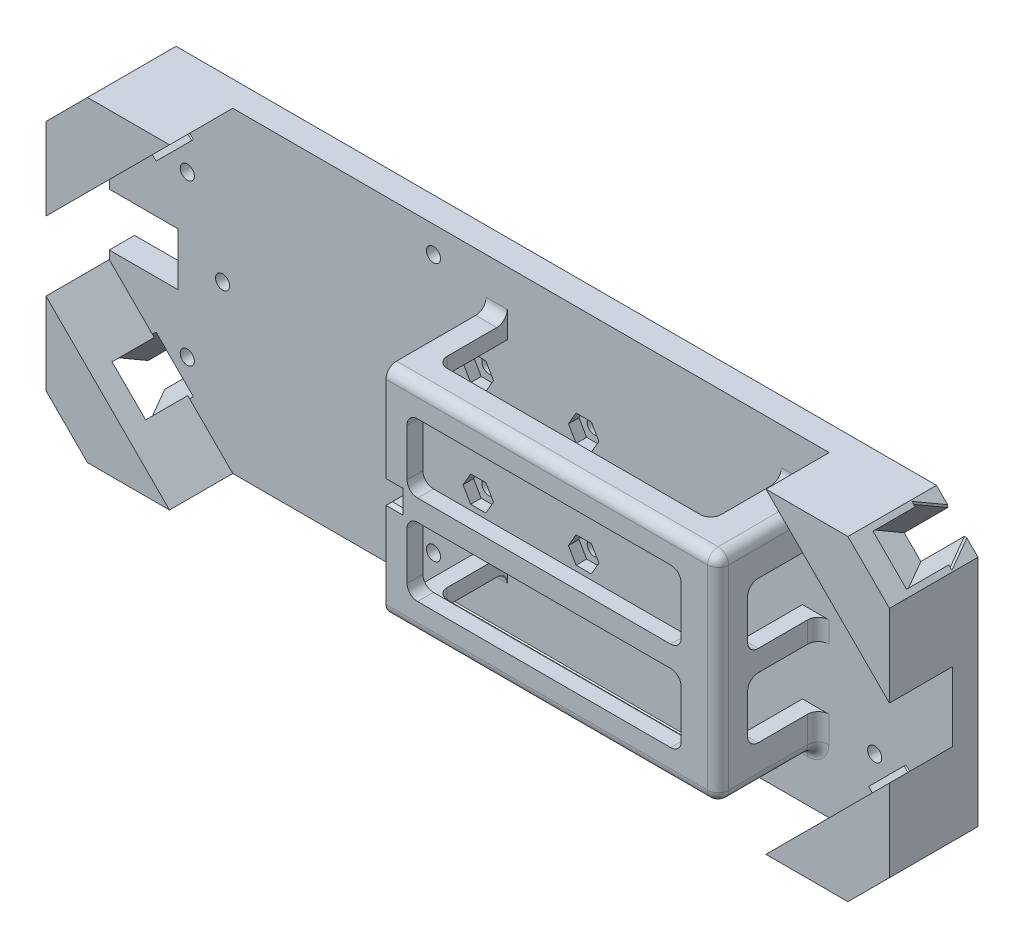
from build123d import *

# Parameters (mm, degrees)
BOSS_EXTRUDE1_DEPTH            = 27.432
BOSS_EXTRUDE2_DEPTH            = 5.08
SKETCH4_R                      = 1.524
CUT_EXTRUDE1_DEPTH             = 2.286
SKETCH4_4_R                    = 1.524
CUT_EXTRUDE2_DEPTH             = 63.630575033
BOSS_EXTRUDE3_DEPTH            = 3.81
FILLET1_R                      = 2.54
CHAMFER3_SIZE                  = 1.27
CHAMFER4_SIZE                  = 0.254
SKETCH8_W                      = 101.6
SKETCH8_H                      = 44.45
CUT_EXTRUDE3_DEPTH             = 5.08
CHAMFER5_SIZE                  = 1.27
BOSS_EXTRUDE4_DEPTH            = 6.096
FILLET2_R                      = 1.27
CUT_EXTRUDE4_DEPTH             = 15.24
MIRROR3_COPY_1_DEPTH           = 15.24
CHAMFER7_SIZE                  = 0.381
SKETCH19_W                     = 135.869666512
SKETCH19_H                     = 67.345799606
CUT_EXTRUDE9_DEPTH             = 31.242
BOSS_EXTRUDE6_DEPTH            = 20.32
SKETCH21_W                     = 80.01
SKETCH21_H                     = 52.07
BOSS_EXTRUDE7_DEPTH            = 3.81
FILLET3_R                      = 2.54
CHAMFER8_SIZE                  = 1.27
BOSS_EXTRUDE8_DEPTH            = 10.16
BOSS_EXTRUDE10_DEPTH           = 5.08
MIRROR13_COPY_1_DEPTH          = 10.16
MIRROR13_COPY_2_DEPTH          = 5.08
CUT_EXTRUDE11_REACH            = 113.159
SKETCH27_R                     = 1.7
SKETCH28_R                     = 3.302
CUT_EXTRUDE12_DEPTH            = 3.302
CUT_EXTRUDE13_REACH            = 114.64
SKETCH29_W                     = 66.04
SKETCH29_H                     = 16.51
SKETCH30_W                     = 66.04
SKETCH30_H                     = 17.018
CUT_EXTRUDE14_DEPTH            = 123.217293784
CUT_EXTRUDE15_REACH            = 178.668
SKETCH31_W                     = 17.018
SKETCH31_H                     = 14.605
SKETCH32_W                     = 66.04
SKETCH32_H                     = 2.54
CUT_EXTRUDE16_DEPTH            = 123.217293784
SKETCH33_W                     = 2.609855045
SKETCH33_H                     = 34.29
CUT_EXTRUDE17_DEPTH            = 3.302
SKETCH34_R                     = 1.7
CUT_EXTRUDE18_DEPTH            = 112.159466084
SKETCH35_R                     = 3.302
CUT_EXTRUDE19_DEPTH            = 3.302
FILLET4_R                      = 2.54
CBORE_FOR_M3_SHCS1_D           = 3.4
CBORE_FOR_M3_SHCS1_CBORE_D     = 6.5
CBORE_FOR_M3_SHCS1_CBORE_DEPTH = 3
MIRROR15_COPY_1_D              = 3.4
MIRROR15_COPY_1_CBORE_D        = 6.5
MIRROR15_COPY_1_CBORE_DEPTH    = 3
CUT_EXTRUDE20_REACH            = 114.64
SKETCH38_W                     = 11.43
SKETCH38_H                     = 7.62
CHAMFER10_SIZE                 = 0.762
M3_CLEARANCE_HOLE1_D           = 3.4
MIRROR17_COPY_1_D              = 3.4
CUT_EXTRUDE21_DEPTH            = 2.54
MIRROR19_COPY_1_DEPTH          = 2.54
CUT_EXTRUDE22_REACH            = 114.64
SKETCH43_W                     = 6.604
SKETCH43_H                     = 4.064
CHAMFER11_SIZE                 = 0.762
SKETCH44_W                     = 33.083921372
SKETCH44_H                     = 12.7
CUT_EXTRUDE23_DEPTH            = 112.159466084


with BuildPart() as part:
    # Sketch1 → Boss-Extrude1 (new body)
    with BuildSketch(Plane(origin=(10.858740921, 0, 0), x_dir=(1, 0, 0), z_dir=(0, 0, 1))):
        Polygon((-52.705, 25.4), (-52.705, 21.59), (48.895, 21.59), (48.895, -22.86), (-52.705, -22.86), (-52.705, -25.4), (52.705, -25.4), (52.705, 25.4), align=None)
    extrude(amount=BOSS_EXTRUDE1_DEPTH)

    # Sketch1<3> → Boss-Extrude2 (add)
    with BuildSketch(Plane(origin=(10.858740921, 0, 0), x_dir=(1, 0, 0), z_dir=(0, 0, 1))):
        Polygon((48.895, 21.59), (-52.705, 21.59), (-52.705, 13.97), (-6.985, 13.97), (-6.985, -6.35), (-52.705, -6.35), (-52.705, -22.86), (48.895, -22.86), align=None)
    extrude(amount=BOSS_EXTRUDE2_DEPTH)

    # Sketch4 → Cut-Extrude1 (cut)
    # profile 1 of 4: a face of its own
    with BuildSketch(Plane(origin=(10.858740921, 0, 5.08), x_dir=(1, 0, 0), z_dir=(0, 0, 1))):
        Polygon((-44.785877438, 21.59), (-47.924122562, 21.59), (-49.493245123, 18.8722), (-47.924122562, 16.1544), (-44.785877438, 16.1544), (-43.216754877, 18.8722), align=None)
        with Locations((-46.355, 18.8722)):
            Circle(SKETCH4_R, mode=Mode.SUBTRACT)
    # profile 2 of 4: a face of its own
    with BuildSketch(Plane(origin=(10.858740921, 0, 5.08), x_dir=(1, 0, 0), z_dir=(0, 0, 1))):
        Polygon((21.126640721, 16.1544), (17.988395597, 16.1544), (16.419273036, 18.8722), (17.988395597, 21.59), (21.126640721, 21.59), (22.695763282, 18.8722), align=None)
        with Locations((19.557518159, 18.8722)):
            Circle(SKETCH4_R, mode=Mode.SUBTRACT)
    # profile 3 of 4: a face of its own
    with BuildSketch(Plane(origin=(10.858740921, 0, 5.08), x_dir=(1, 0, 0), z_dir=(0, 0, 1))):
        Polygon((22.695763282, -18.8722), (21.126640721, -16.1544), (17.988395597, -16.1544), (16.419273036, -18.8722), (17.988395597, -21.59), (21.126640721, -21.59), align=None)
        with Locations((19.557518159, -18.8722)):
            Circle(SKETCH4_R, mode=Mode.SUBTRACT)
    # profile 4 of 4: a face of its own
    with BuildSketch(Plane(origin=(10.858740921, 0, 5.08), x_dir=(1, 0, 0), z_dir=(0, 0, 1))):
        Polygon((-49.493245123, -18.8722), (-47.924122562, -16.1544), (-44.785877438, -16.1544), (-43.216754877, -18.8722), (-44.785877438, -21.59), (-47.924122562, -21.59), align=None)
        with Locations((-46.355, -18.8722)):
            Circle(SKETCH4_R, mode=Mode.SUBTRACT)
    extrude(amount=-CUT_EXTRUDE1_DEPTH, mode=Mode.SUBTRACT)

    # Sketch4<4> → Cut-Extrude2 (cut, through all)
    with BuildSketch(Plane(origin=(10.858740921, 0, 5.08), x_dir=(1, 0, 0), z_dir=(0, 0, 1))):
        with Locations((-46.355, 18.8722)):
            Circle(SKETCH4_4_R)
        with Locations((19.557518159, 18.8722)):
            Circle(SKETCH4_4_R)
        with Locations((-46.355, -18.8722)):
            Circle(SKETCH4_4_R)
        with Locations((19.557518159, -18.8722)):
            Circle(SKETCH4_4_R)
    extrude(amount=-CUT_EXTRUDE2_DEPTH, mode=Mode.SUBTRACT)

    # Sketch7 → Boss-Extrude3 (add)
    with BuildSketch(Plane(origin=(10.858740921, 0, 27.432), x_dir=(1, 0, 0), z_dir=(0, 0, 1))):
        Polygon((-52.705, 25.4), (52.705, 25.4), (52.705, -25.4), (-52.705, -25.4), (-52.705, -6.35), (-46.355, -6.35), (-46.355, 6.35), (-52.705, 6.35), align=None)
    extrude(amount=BOSS_EXTRUDE3_DEPTH)

    # Fillet1
    fillet1_edges = [part.edges().sort_by_distance(p)[0] for p in [
        (63.563740921, 25.4, 15.621),
        (63.563740921, -25.4, 15.621),
        (10.858740921, -25.4, 31.242),
        (63.563740921, 0, 31.242),
        (10.858740921, 25.4, 31.242),
    ]]
    fillet(fillet1_edges, radius=FILLET1_R)

    # Chamfer3
    chamfer3_edges = [part.edges().sort_by_distance(p)[0] for p in [
        (-41.846259079, 13.97, 27.432),
        (-41.846259079, 6.35, 29.337),
        (-41.846259079, 21.59, 16.256),
        (-41.846259079, -14.605, 27.432),
        (-41.846259079, -6.35, 29.337),
        (-38.671259079, 6.35, 31.242),
        (-35.496259079, 0, 31.242),
        (-38.671259079, -6.35, 31.242),
        (-41.846259079, -22.86, 16.256),
    ]]
    chamfer(chamfer3_edges, length=CHAMFER3_SIZE)

    # Chamfer4
    chamfer4_edges = [part.edges().sort_by_distance(p)[0] for p in [
        (28.892259079, 18.8722, 0),
        (-37.020259079, -18.8722, 0),
        (28.892259079, -18.8722, 0),
        (-37.020259079, 18.8722, 0),
    ]]
    chamfer(chamfer4_edges, length=CHAMFER4_SIZE)

    # Sketch8 → Cut-Extrude3 (cut)
    with BuildSketch(Plane(origin=(10.858740921, 0, 5.08), x_dir=(1, 0, 0), z_dir=(0, 0, 1))):
        with Locations((-1.905, -0.635)):
            Rectangle(SKETCH8_W, SKETCH8_H)
    extrude(amount=-CUT_EXTRUDE3_DEPTH, mode=Mode.SUBTRACT)

    # Chamfer5
    chamfer5_edges = [part.edges().sort_by_distance(p)[0] for p in [
        (-41.846259079, -22.86, 2.54),
        (-41.846259079, 21.59, 2.54),
    ]]
    chamfer(chamfer5_edges, length=CHAMFER5_SIZE)

    # Sketch9 → Boss-Extrude4 (add)
    with BuildSketch(Plane(origin=(10.858740921, 0, 0), x_dir=(-1, 0, 0), z_dir=(0, 0, -1))):
        Polygon((-90.741259079, 28.1), (-80.741259079, 38.1), (102.458740921, 38.1), (112.458740921, 28.1), (112.458740921, -28.1), (102.458740921, -38.1), (-80.741259079, -38.1), (-90.741259079, -28.1), align=None)
    extrude(amount=BOSS_EXTRUDE4_DEPTH)

    # Fillet2
    fillet2_edges = [part.edges().sort_by_distance(p)[0] for p in [
        (9.588740921, -25.4, 0),
        (63.563740921, 0, 0),
        (9.588740921, 25.4, 0),
        (62.819792145, 24.656051224, 0),
        (62.819792145, -24.656051224, 0),
    ]]
    fillet(fillet2_edges, radius=FILLET2_R)

    # Sketch13 → Cut-Extrude4 (cut)
    with BuildSketch(Plane(origin=(-64.85, 64.85, 0), x_dir=(0, 0, 1), z_dir=(-0.7071067811865477, 0.7071067811865474, 0))):
        Polygon((-6.096, -44.901280605), (-6.096, -42.070807846), (0, -38.551280605), (0, -51.251280605), (-6.096, -47.731753364), align=None)
    cut_extrude4 = extrude(amount=-CUT_EXTRUDE4_DEPTH, mode=Mode.SUBTRACT)

    # Mirror2: Cut-Extrude4 across plane
    add(cut_extrude4.mirror(Plane.ZX), mode=Mode.SUBTRACT)

    # Mirror3: Cut-Extrude4 across plane
    add(cut_extrude4.mirror(Plane(origin=(0, 0, 0), x_dir=(0, 0, 1), z_dir=(1, 0, 0))), mode=Mode.SUBTRACT)

    # Mirror3 copy 1 sketch → Mirror3 copy 1 (cut)
    with BuildSketch(Plane(origin=(64.85, -64.85, 0), x_dir=(0, 0, 1), z_dir=(0.7071067811865477, -0.7071067811865474, 0))):
        Polygon((-6.096, -44.901280605), (-6.096, -42.070807846), (0, -38.551280605), (0, -51.251280605), (-6.096, -47.731753364), align=None)
    extrude(amount=-MIRROR3_COPY_1_DEPTH, mode=Mode.SUBTRACT)

    # Chamfer7
    chamfer7_edges = [part.edges().sort_by_distance(p)[0] for p in [
        (-99.845787271, 29.854212729, -3.048),
        (-93.354212729, 36.345787271, -3.048),
        (-99.845787271, -29.854212729, -3.048),
        (-93.354212729, -36.345787271, -3.048),
        (99.845787271, 29.854212729, -3.048),
        (93.354212729, 36.345787271, -3.048),
        (99.845787271, -29.854212729, -3.048),
        (93.354212729, -36.345787271, -3.048),
    ]]
    chamfer(chamfer7_edges, length=CHAMFER7_SIZE)

    # Sketch19 → Cut-Extrude9 (cut)
    with BuildSketch(Plane.XY.offset(31.242)):
        Rectangle(SKETCH19_W, SKETCH19_H)
    extrude(amount=-CUT_EXTRUDE9_DEPTH, mode=Mode.SUBTRACT)

    # Sketch20 → Boss-Extrude6 (add)
    with BuildSketch(Plane.XY):
        Polygon((65.405, 22.86), (65.405, -21.59), (-10.795, -21.59), (-10.795, -25.4), (69.215, -25.4), (69.215, 26.67), (-10.795, 26.67), (-10.795, 22.86), align=None)
    extrude(amount=BOSS_EXTRUDE6_DEPTH)

    # Sketch21 → Boss-Extrude7 (add)
    with BuildSketch(Plane.XY.offset(20.32)):
        with Locations((29.21, 0.635)):
            Rectangle(SKETCH21_W, SKETCH21_H)
    extrude(amount=BOSS_EXTRUDE7_DEPTH)

    # Fillet3
    fillet3_edges = [part.edges().sort_by_distance(p)[0] for p in [
        (29.21, -25.4, 0),
        (69.215, 0.635, 0),
        (69.215, -25.4, 12.065),
        (29.21, 26.67, 0),
        (69.215, 26.67, 12.065),
        (29.21, -25.4, 24.13),
        (69.215, 0.635, 24.13),
        (29.21, 26.67, 24.13),
    ]]
    fillet(fillet3_edges, radius=FILLET3_R)

    # Chamfer8
    chamfer8_edges = [part.edges().sort_by_distance(p)[0] for p in [
        (-10.795, 22.86, 10.16),
        (-10.795, -21.59, 10.16),
        (-10.795, 0.635, 20.32),
    ]]
    chamfer(chamfer8_edges, length=CHAMFER8_SIZE)

    # Sketch24 → Boss-Extrude8 (add)
    with BuildSketch(Plane.XY):
        Polygon((-90.762833521, 19.180603012), (-101.6, 8.343436534), (-101.6, 28.1), (-100.641115254, 29.058884746), align=None)
        Polygon((-92.558884746, 37.141115254), (-91.6, 38.1), (-71.843436534, 38.1), (-82.680603012, 27.262833521), align=None)
    boss_extrude8 = extrude(amount=BOSS_EXTRUDE8_DEPTH)

    # Sketch26 → Boss-Extrude10 (add)
    with BuildSketch(Plane.XY.offset(10.16)):
        Polygon((-101.6, 8.343436534), (-71.843436534, 38.1), (-91.6, 38.1), (-101.6, 28.1), align=None)
    boss_extrude10 = extrude(amount=BOSS_EXTRUDE10_DEPTH)

    # Mirror12: Boss-Extrude8, Boss-Extrude10 across plane
    add(boss_extrude8.mirror(Plane.ZX))
    add(boss_extrude10.mirror(Plane.ZX))

    # Mirror13: Boss-Extrude8, Boss-Extrude10 across plane
    add(boss_extrude8.mirror(Plane(origin=(0, 0, 0), x_dir=(0, 0, 1), z_dir=(1, 0, 0))))
    add(boss_extrude10.mirror(Plane(origin=(0, 0, 0), x_dir=(0, 0, 1), z_dir=(1, 0, 0))))

    # Mirror13 copy 1 sketch → Mirror13 copy 1 (add)
    with BuildSketch(Plane(origin=(0, 0, 0), x_dir=(-1, 0, 0), z_dir=(0, 0, 1))):
        Polygon((-90.762833521, 19.180603012), (-101.6, 8.343436534), (-101.6, 28.1), (-100.641115254, 29.058884746), align=None)
        Polygon((-92.558884746, 37.141115254), (-91.6, 38.1), (-71.843436534, 38.1), (-82.680603012, 27.262833521), align=None)
    extrude(amount=MIRROR13_COPY_1_DEPTH)

    # Mirror13 copy 2 sketch → Mirror13 copy 2 (add)
    with BuildSketch(Plane(origin=(0, 0, 10.16), x_dir=(-1, 0, 0), z_dir=(0, 0, 1))):
        Polygon((-101.6, 8.343436534), (-71.843436534, 38.1), (-91.6, 38.1), (-101.6, 28.1), align=None)
    extrude(amount=MIRROR13_COPY_2_DEPTH)

    # Sketch27 → Cut-Extrude11 (cut, up to next)
    with BuildSketch(Plane.XY, mode=Mode.PRIVATE) as cut_extrude11_sk1:
        with Locations((-23.495, 31.75)):
            Circle(SKETCH27_R)
    cut_extrude11_tool1 = extrude(cut_extrude11_sk1.sketch, amount=-CUT_EXTRUDE11_REACH, mode=Mode.PRIVATE) & part.part
    # Sketch27 → Cut-Extrude11 (cut, up to next)
    with BuildSketch(Plane.XY, mode=Mode.PRIVATE) as cut_extrude11_sk2:
        with Locations((-23.495, -30.48)):
            Circle(SKETCH27_R)
    cut_extrude11_tool2 = extrude(cut_extrude11_sk2.sketch, amount=-CUT_EXTRUDE11_REACH, mode=Mode.PRIVATE) & part.part
    add(cut_extrude11_tool1.solids().sort_by_distance((-23.495, 31.75, 0))[0], mode=Mode.SUBTRACT)
    add(cut_extrude11_tool2.solids().sort_by_distance((-23.495, -30.48, 0))[0], mode=Mode.SUBTRACT)

    # Sketch28 → Cut-Extrude12 (cut)
    with BuildSketch(Plane(origin=(0, 0, -6.096), x_dir=(-1, 0, 0), z_dir=(0, 0, -1))):
        with Locations((23.495, -30.48)):
            Circle(SKETCH28_R)
        with Locations((23.495, 31.75)):
            Circle(SKETCH28_R)
    extrude(amount=-CUT_EXTRUDE12_DEPTH, mode=Mode.SUBTRACT)

    # Sketch29 → Cut-Extrude13 (cut, up to next)
    with BuildSketch(Plane.XY.offset(24.13), mode=Mode.PRIVATE) as cut_extrude13_sk1:
        with Locations((27.305, 11.43)):
            Rectangle(SKETCH29_W, SKETCH29_H)
    cut_extrude13_tool1 = extrude(cut_extrude13_sk1.sketch, amount=-CUT_EXTRUDE13_REACH, mode=Mode.PRIVATE) & part.part
    # Sketch29 → Cut-Extrude13 (cut, up to next)
    with BuildSketch(Plane.XY.offset(24.13), mode=Mode.PRIVATE) as cut_extrude13_sk2:
        with Locations((27.305, -10.16)):
            Rectangle(SKETCH29_W, SKETCH29_H)
    cut_extrude13_tool2 = extrude(cut_extrude13_sk2.sketch, amount=-CUT_EXTRUDE13_REACH, mode=Mode.PRIVATE) & part.part
    add(cut_extrude13_tool1.solids().sort_by_distance((27.305, 11.43, 24.13))[0], mode=Mode.SUBTRACT)
    add(cut_extrude13_tool2.solids().sort_by_distance((27.305, -10.16, 24.13))[0], mode=Mode.SUBTRACT)

    # Sketch30 → Cut-Extrude14 (cut, through all)
    with BuildSketch(Plane.XZ.offset(25.4)):
        with Locations((27.305, 8.509)):
            Rectangle(SKETCH30_W, SKETCH30_H)
    extrude(amount=-CUT_EXTRUDE14_DEPTH, mode=Mode.SUBTRACT)

    # Sketch31 → Cut-Extrude15 (cut, up to next)
    with BuildSketch(Plane(origin=(69.215, 0, 0), x_dir=(0, 0, -1), z_dir=(1, 0, 0)), mode=Mode.PRIVATE) as cut_extrude15_sk1:
        with Locations((-8.509, 10.4775)):
            Rectangle(SKETCH31_W, SKETCH31_H)
    cut_extrude15_tool1 = extrude(cut_extrude15_sk1.sketch, amount=-CUT_EXTRUDE15_REACH, mode=Mode.PRIVATE) & part.part
    # Sketch31 → Cut-Extrude15 (cut, up to next)
    with BuildSketch(Plane(origin=(69.215, 0, 0), x_dir=(0, 0, -1), z_dir=(1, 0, 0)), mode=Mode.PRIVATE) as cut_extrude15_sk2:
        with Locations((-8.509, -9.2075)):
            Rectangle(SKETCH31_W, SKETCH31_H)
    cut_extrude15_tool2 = extrude(cut_extrude15_sk2.sketch, amount=-CUT_EXTRUDE15_REACH, mode=Mode.PRIVATE) & part.part
    add(cut_extrude15_tool1.solids().sort_by_distance((69.215, 10.4775, 8.509))[0], mode=Mode.SUBTRACT)
    add(cut_extrude15_tool2.solids().sort_by_distance((69.215, -9.2075, 8.509))[0], mode=Mode.SUBTRACT)

    # Sketch32 → Cut-Extrude16 (cut, through all)
    with BuildSketch(Plane(origin=(0, -25.4, 0), x_dir=(1, 0, 0), z_dir=(0, 1, 0))):
        with Locations((27.305, -1.27)):
            Rectangle(SKETCH32_W, SKETCH32_H)
    extrude(amount=-CUT_EXTRUDE16_DEPTH, mode=Mode.SUBTRACT)

    # Sketch33 → Cut-Extrude17 (cut)
    with BuildSketch(Plane.ZY.offset(-69.215)):
        with Locations((1.304927523, 0.635)):
            Rectangle(SKETCH33_W, SKETCH33_H)
    extrude(amount=-CUT_EXTRUDE17_DEPTH, mode=Mode.SUBTRACT)

    # Sketch34 → Cut-Extrude18 (cut, through all)
    with BuildSketch(Plane.XY):
        with Locations((-74.295, 0.635)):
            Circle(SKETCH34_R)
    extrude(amount=-CUT_EXTRUDE18_DEPTH, mode=Mode.SUBTRACT)

    # Sketch35 → Cut-Extrude19 (cut)
    with BuildSketch(Plane(origin=(0, 0, -6.096), x_dir=(-1, 0, 0), z_dir=(0, 0, -1))):
        with Locations((74.295, 0.635)):
            Circle(SKETCH35_R)
    extrude(amount=-CUT_EXTRUDE19_DEPTH, mode=Mode.SUBTRACT)

    # Fillet4
    fillet4_edges = [part.edges().sort_by_distance(p)[0] for p in [
        (60.325, 3.175, 22.225),
        (60.325, 19.685, 22.225),
        (-5.715, 19.685, 22.225),
        (-5.715, 3.175, 22.225),
        (-5.715, -1.905, 22.225),
        (-5.715, -18.415, 22.225),
        (60.325, -18.415, 22.225),
        (60.325, -1.905, 22.225),
        (-5.715, 24.765, 17.018),
        (-5.715, -23.495, 17.018),
        (60.325, 24.765, 17.018),
        (60.325, -23.495, 17.018),
        (67.31, 3.175, 17.018),
        (67.31, 17.78, 17.018),
        (67.31, -16.51, 17.018),
        (67.31, -1.905, 17.018),
        (69.215, 0.635, 0),
    ]]
    fillet(fillet4_edges, radius=FILLET4_R)

    # CBORE for M3 SHCS1 (through all)
    with Locations(Plane(origin=(0, 0, -6.096), x_dir=(-1, 0, 0), z_dir=(0, 0, -1))):
        with Locations((82.804, -19.304)):
            cbore_for_m3_shcs1 = CounterBoreHole(CBORE_FOR_M3_SHCS1_D / 2, CBORE_FOR_M3_SHCS1_CBORE_D / 2, CBORE_FOR_M3_SHCS1_CBORE_DEPTH)

    # Mirror14: CBORE for M3 SHCS1 across plane
    add(cbore_for_m3_shcs1.mirror(Plane.ZX), mode=Mode.SUBTRACT)

    # Mirror15: CBORE for M3 SHCS1 across plane
    add(cbore_for_m3_shcs1.mirror(Plane(origin=(0, 0, 0), x_dir=(0, 0, 1), z_dir=(1, 0, 0))), mode=Mode.SUBTRACT)

    # Mirror15 copy 1 (through all)
    with Locations(Plane(origin=(0, 0, -6.096), x_dir=(1, 0, 0), z_dir=(0, 0, -1))):
        with Locations((82.804, -19.304)):
            CounterBoreHole(MIRROR15_COPY_1_D / 2, MIRROR15_COPY_1_CBORE_D / 2, MIRROR15_COPY_1_CBORE_DEPTH)

    # Sketch38 → Cut-Extrude20 (cut, up to next)
    with BuildSketch(Plane(origin=(0, 0, -6.096), x_dir=(-1, 0, 0), z_dir=(0, 0, -1)), mode=Mode.PRIVATE) as cut_extrude20_sk1:
        Rectangle(SKETCH38_W, SKETCH38_H)
    cut_extrude20_tool1 = extrude(cut_extrude20_sk1.sketch, amount=-CUT_EXTRUDE20_REACH, mode=Mode.PRIVATE) & part.part
    add(cut_extrude20_tool1.solids().sort_by_distance((0, 0, -6.096))[0], mode=Mode.SUBTRACT)

    # Chamfer10
    chamfer10_edges = [part.edges().sort_by_distance(p)[0] for p in [
        (-5.715, 0, -6.096),
        (0, 3.81, -6.096),
        (5.715, 0, -6.096),
        (0, -3.81, -6.096),
    ]]
    chamfer(chamfer10_edges, length=CHAMFER10_SIZE)

    # M3 Clearance Hole1 (through all)
    with Locations(Plane(origin=(0, 0, -6.096), x_dir=(-1, 0, 0), z_dir=(0, 0, -1))):
        with Locations((12.7, 12.7)):
            m3_clearance_hole1 = Hole(M3_CLEARANCE_HOLE1_D / 2)

    # Mirror16: M3 Clearance Hole1 across plane
    add(m3_clearance_hole1.mirror(Plane.ZX), mode=Mode.SUBTRACT)

    # Mirror17: M3 Clearance Hole1 across plane
    add(m3_clearance_hole1.mirror(Plane(origin=(0, 0, 0), x_dir=(0, 0, 1), z_dir=(1, 0, 0))), mode=Mode.SUBTRACT)

    # Mirror17 copy 1 (through all)
    with Locations(Plane(origin=(0, 0, -6.096), x_dir=(1, 0, 0), z_dir=(0, 0, -1))):
        with Locations((12.7, 12.7)):
            Hole(MIRROR17_COPY_1_D / 2)

    # Sketch42 → Cut-Extrude21 (cut)
    with BuildSketch(Plane.XY):
        Polygon((16.366174209, 12.7), (14.533087105, 15.875), (10.866912895, 15.875), (9.033825791, 12.7), (10.866912895, 9.525), (14.533087105, 9.525), align=None)
    cut_extrude21 = extrude(amount=-CUT_EXTRUDE21_DEPTH, mode=Mode.SUBTRACT)

    # Mirror18: Cut-Extrude21 across plane
    add(cut_extrude21.mirror(Plane(origin=(0, 0, 0), x_dir=(0, 0, 1), z_dir=(1, 0, 0))), mode=Mode.SUBTRACT)

    # Mirror19: Cut-Extrude21 across plane
    add(cut_extrude21.mirror(Plane.ZX), mode=Mode.SUBTRACT)

    # Mirror19 copy 1 sketch → Mirror19 copy 1 (cut)
    with BuildSketch(Plane(origin=(0, 0, 0), x_dir=(-1, 0, 0), z_dir=(0, 0, 1))):
        Polygon((16.366174209, 12.7), (14.533087105, 15.875), (10.866912895, 15.875), (9.033825791, 12.7), (10.866912895, 9.525), (14.533087105, 9.525), align=None)
    extrude(amount=-MIRROR19_COPY_1_DEPTH, mode=Mode.SUBTRACT)

    # Sketch43 → Cut-Extrude22 (cut, up to next)
    with BuildSketch(Plane.XY.offset(24.13), mode=Mode.PRIVATE) as cut_extrude22_sk1:
        with Locations((-10.795, 0.635)):
            Rectangle(SKETCH43_W, SKETCH43_H)
    cut_extrude22_tool1 = extrude(cut_extrude22_sk1.sketch, amount=-CUT_EXTRUDE22_REACH, mode=Mode.PRIVATE) & part.part
    add(cut_extrude22_tool1.solids().sort_by_distance((-10.795, 0.635, 24.13))[0], mode=Mode.SUBTRACT)

    # Chamfer11
    chamfer11_edges = [part.edges().sort_by_distance(p)[0] for p in [
        (-9.144, 2.667, 24.13),
        (-9.144, -1.397, 24.13),
        (-7.493, 0.635, 24.13),
        (-10.795, -1.397, 22.86),
        (-10.795, 2.667, 22.86),
    ]]
    chamfer(chamfer11_edges, length=CHAMFER11_SIZE)

    # Sketch44 → Cut-Extrude23 (cut, through all)
    with BuildSketch(Plane.XY):
        with Locations((-101.6, 0)):
            Rectangle(SKETCH44_W, SKETCH44_H)
    extrude(amount=-CUT_EXTRUDE23_DEPTH, mode=Mode.SUBTRACT)


solid = part.part
